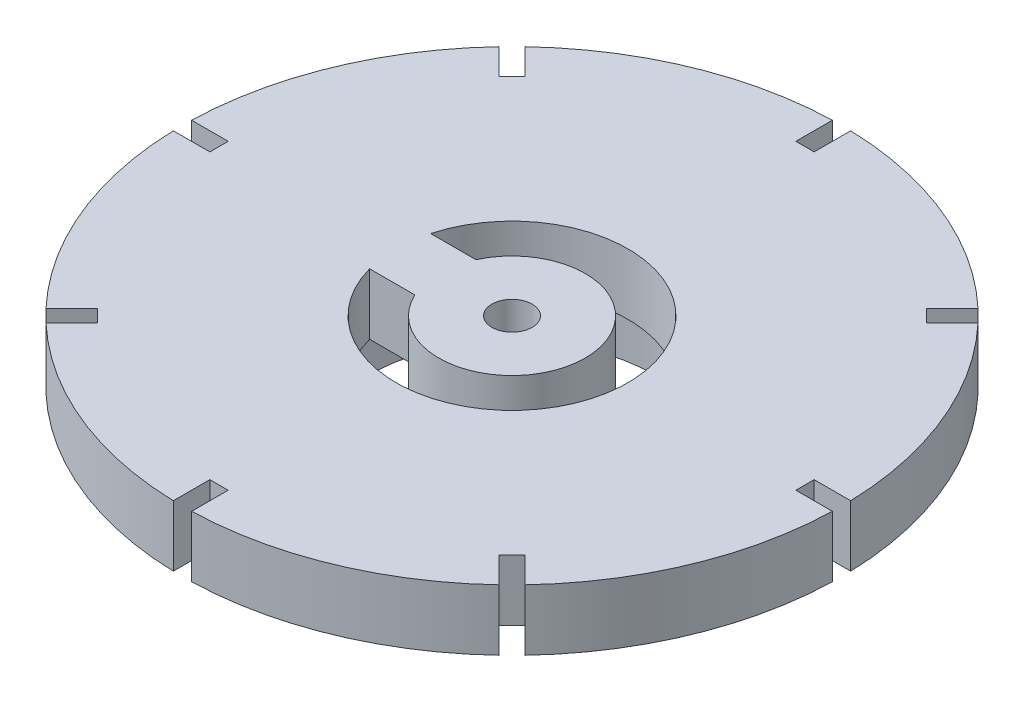
from build123d import *

# Parameters (mm, degrees)
BOSS_EXTRUDE1_DEPTH = 5
SKETCH2_R           = 27
BOSS_EXTRUDE2_DEPTH = 5
SKETCH4_R           = 3
CUT_EXTRUDE1_DEPTH  = 2.5
CUT_EXTRUDE2_DEPTH  = 39.509739028
SKETCH6_W           = 4.309180809
SKETCH6_H           = 1.5
CUT_EXTRUDE3_DEPTH  = 40.471508712
CIRPATTERN1_COUNT   = 8
SKETCH7_R           = 1.65
CUT_EXTRUDE4_DEPTH  = 40.457255353


with BuildPart() as part:
    # Sketch1 → Boss-Extrude1 (new body)
    with BuildSketch(Plane(origin=(0, 0, 0), x_dir=(1, 0, 0), z_dir=(0, 1, 0))):
        with BuildLine():
            ThreePointArc((0, -15), (15, 0), (0, 15))
            ThreePointArc((0, 15), (-15, 0), (0, -15))
        make_face()
        with BuildLine():
            ThreePointArc((0, -11.65), (11.65, 0), (0, 11.65))
            ThreePointArc((0, 11.65), (-11.65, 0), (0, -11.65))
        make_face(mode=Mode.SUBTRACT)
    extrude(amount=BOSS_EXTRUDE1_DEPTH)

    # Sketch2 → Boss-Extrude2 (add)
    with BuildSketch(Plane(origin=(0, 5, 0), x_dir=(1, 0, 0), z_dir=(0, 1, 0))):
        with Locations(Location((0, 0, 0), (0, 0, 270))):
            Circle(SKETCH2_R)
    extrude(amount=BOSS_EXTRUDE2_DEPTH)

    # Sketch4 → Cut-Extrude1 (cut)
    with BuildSketch(Plane.XZ.offset(-5)):
        with Locations(Location((0, 0, 0), (0, 0, 270))):
            Circle(SKETCH4_R)
    extrude(amount=-CUT_EXTRUDE1_DEPTH, mode=Mode.SUBTRACT)

    # Sketch5 → Cut-Extrude2 (cut, through all)
    with BuildSketch(Plane.XZ.offset(-5)):
        with BuildLine():
            Line((-9.16515139, 2.5), (-5.454356057, 2.5))
            ThreePointArc((-5.454356057, 2.5), (6, 0), (-5.454356057, -2.5))
            Line((-5.454356057, -2.5), (-9.16515139, -2.5))
            ThreePointArc((-9.16515139, -2.5), (9.5, 0), (-9.16515139, 2.5))
        make_face()
    extrude(amount=-CUT_EXTRUDE2_DEPTH, mode=Mode.SUBTRACT)

    # Sketch6 → Cut-Extrude3 (cut, through all)
    with BuildSketch(Plane(origin=(0, 10, 0), x_dir=(1, 0, 0), z_dir=(0, 1, 0))):
        with Locations((-26.154590404, 0)):
            Rectangle(SKETCH6_W, SKETCH6_H)
    cut_extrude3 = extrude(amount=-CUT_EXTRUDE3_DEPTH, mode=Mode.SUBTRACT)

    # CirPattern1: Cut-Extrude3 ×8 about axis
    cirpattern1_axis = Axis((0, 0, 0), (0, 1, 0))
    for i in range(1, CIRPATTERN1_COUNT):
        add(cut_extrude3.rotate(cirpattern1_axis, i * 360 / CIRPATTERN1_COUNT), mode=Mode.SUBTRACT)

    # Sketch7 → Cut-Extrude4 (cut, through all)
    with BuildSketch(Plane(origin=(0, 10, 0), x_dir=(1, 0, 0), z_dir=(0, 1, 0))):
        with Locations(Location((0, 0, 0), (0, 0, 270))):
            Circle(SKETCH7_R)
    extrude(amount=-CUT_EXTRUDE4_DEPTH, mode=Mode.SUBTRACT)


solid = part.part
